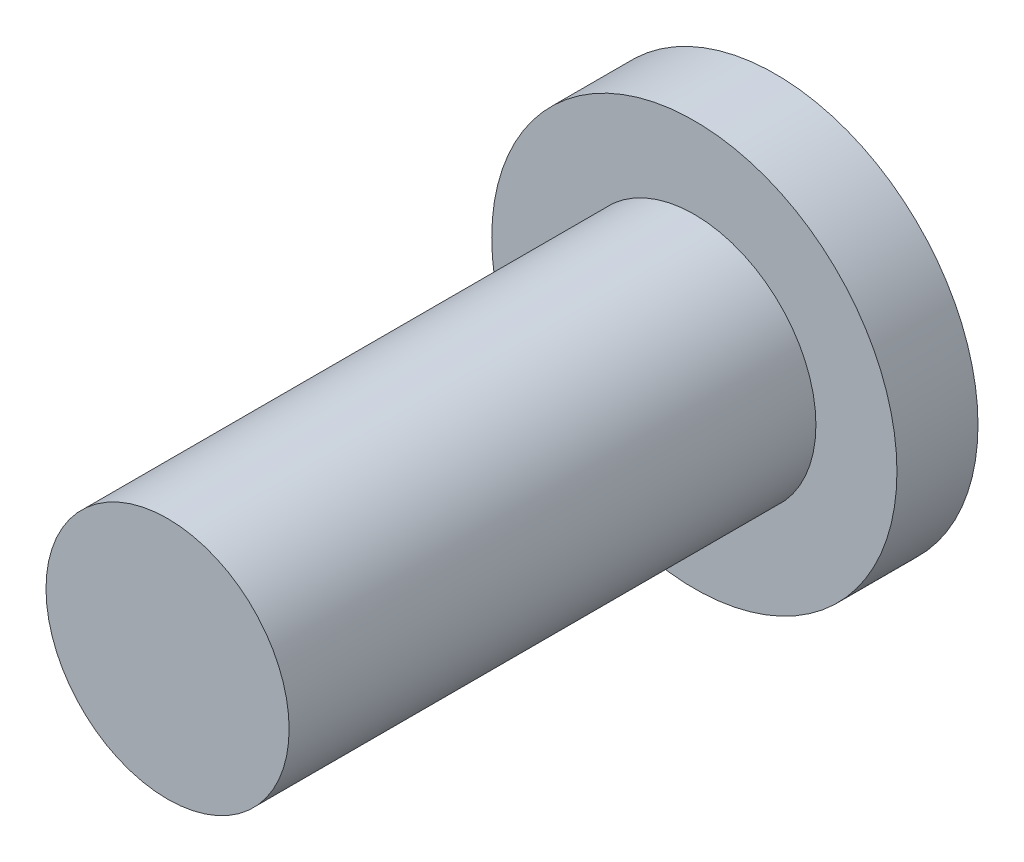
from build123d import *

# Parameters (mm, degrees)
SKETCH1_R           = 3
BOSS_EXTRUDE4_DEPTH = 13
SKETCH2_R           = 5
BOSS_EXTRUDE5_DEPTH = 2


with BuildPart() as part:
    # Sketch1 → Boss-Extrude4 (new body)
    with BuildSketch(Plane.XY):
        with Locations(Location((0, 0, 0), (0, 0, 180))):
            Circle(SKETCH1_R)
    extrude(amount=BOSS_EXTRUDE4_DEPTH)

    # Sketch2 → Boss-Extrude5 (add)
    with BuildSketch(Plane(origin=(0, 0, 0), x_dir=(-1, 0, 0), z_dir=(0, 0, -1))):
        Circle(SKETCH2_R)
    extrude(amount=BOSS_EXTRUDE5_DEPTH)


solid = part.part
